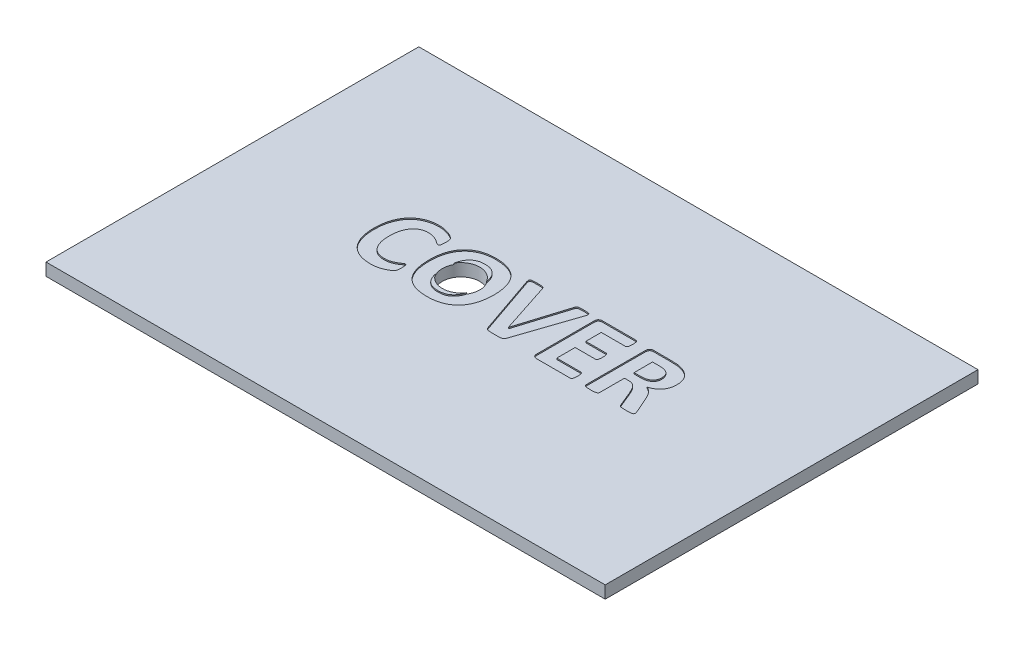
from build123d import *

# Parameters (mm, degrees)
SKETCH1_W           = 450
SKETCH1_H           = 300
BOSS_EXTRUDE1_DEPTH = 10
CUT_EXTRUDE1_DEPTH  = 1
SKETCH3_R           = 15
CUT_EXTRUDE2_DEPTH  = 271.601182693


with BuildPart() as part:
    # Sketch1 → Boss-Extrude1 (new body)
    with BuildSketch(Plane(origin=(0, 0, 0), x_dir=(1, 0, 0), z_dir=(0, 1, 0))):
        Rectangle(SKETCH1_W, SKETCH1_H)
    extrude(amount=BOSS_EXTRUDE1_DEPTH)

    # Sketch2 → Cut-Extrude1 (cut)
    # profile 1 of 5: a face of its own
    with BuildSketch(Plane(origin=(0, 10, 0), x_dir=(1, 0, 0), z_dir=(0, 1, 0))):
        with BuildLine():
            add(Edge.make_bspline(
                [(-77.818627451, -11.20892693), (-77.819056392, -11.517074485), (-77.819847219, -12.08519854), (-77.872230209, -12.871963567), (-77.938067574, -13.535120677), (-78.046155431, -14.093776503), (-78.194888149, -14.565881027), (-78.382858739, -14.998336928), (-78.685088776, -15.422095953), (-78.990876267, -15.821535788), (-79.331447604, -16.201915471), (-79.719445094, -16.524783346), (-80.203030404, -16.902006839), (-81.024618762, -17.468743643), (-82.254477753, -18.184569426), (-83.951977466, -19.004093757), (-85.941522487, -19.709448564), (-88.176283277, -20.306930184), (-90.652982254, -20.707571668), (-92.37964478, -20.754110015), (-93.272920496, -20.778186275)],
                knots=[0, 0, 0, 0, 0.817477301, 1.507162764, 2.091525744, 2.585101367, 3.013698999, 3.403571139, 3.830139735, 4.389521305, 4.739690108, 5.181838318, 5.726127005, 6.367582384, 7.828489835, 9.497787956, 11.362220851, 13.420571043, 15.630867283, 18, 18, 18, 18], degree=3))
            add(Edge.make_bspline(
                [(-93.272920496, -20.778186275), (-94.15329617, -20.756167544), (-95.870805135, -20.7132116), (-98.387183182, -20.406641566), (-100.769794298, -19.888070954), (-103.019268155, -19.156998664), (-105.126176828, -18.224133996), (-107.065135058, -17.057672287), (-108.85634638, -15.705684369), (-110.469499253, -14.134736199), (-111.918111815, -12.3609713), (-113.16386307, -10.363181982), (-114.254794546, -8.175248658), (-115.147706509, -5.777191015), (-115.874822855, -3.180917671), (-116.349261609, -0.372355939), (-116.685308961, 2.628193609), (-116.713441094, 4.698280804), (-116.727941176, 5.765261183)],
                knots=[0, 0, 0, 0, 1.04884528, 2.046173269, 3.015214692, 3.949843553, 4.859908047, 5.754373417, 6.640074381, 7.528023805, 8.430832778, 9.361986752, 10.3273752, 11.339120453, 12.406480085, 13.534714217, 14.729323304, 16, 16, 16, 16], degree=3))
            add(Edge.make_bspline(
                [(-116.727941176, 5.765261183), (-116.709421328, 6.856525006), (-116.673386635, 8.979833717), (-116.32231019, 12.06947672), (-115.772645125, 14.971400049), (-114.994251564, 17.682376672), (-114.008653042, 20.192322768), (-112.841474036, 22.504738019), (-111.489455304, 24.604401381), (-109.961046173, 26.497481008), (-108.249087683, 28.161458028), (-106.392555758, 29.639723814), (-104.360431283, 30.882569218), (-102.176180664, 31.901949539), (-99.858612465, 32.709718645), (-97.415898466, 33.270625779), (-94.860954858, 33.642368443), (-93.116202247, 33.677137663), (-92.22723269, 33.694852941)],
                knots=[0, 0, 0, 0, 1.247364886, 2.427039795, 3.55045214, 4.621200906, 5.64704897, 6.629476075, 7.578181143, 8.497404382, 9.405200954, 10.302706402, 11.205651615, 12.122019826, 13.054178336, 14.006318378, 14.984198529, 16, 16, 16, 16], degree=3))
            add(Edge.make_bspline(
                [(-92.22723269, 33.694852941), (-91.504811834, 33.676204752), (-90.082836554, 33.639498635), (-88.004752592, 33.34953391), (-86.05159818, 32.916201496), (-84.241203878, 32.364338105), (-82.587322738, 31.733463915), (-81.346190212, 31.10277163), (-80.470525668, 30.589526285), (-79.923710494, 30.246611478), (-79.489859624, 29.914630755), (-79.081949007, 29.533243086), (-78.709479477, 29.127043954), (-78.381689893, 28.673729628), (-78.18498315, 28.193912462), (-78.049228642, 27.653022263), (-77.937359141, 27.006781902), (-77.872681032, 26.24637118), (-77.819224155, 25.338208797), (-77.818838943, 24.680977851), (-77.818627451, 24.320140165)],
                knots=[0, 0, 0, 0, 1.99247574, 3.921884623, 5.777623321, 7.507428254, 9.139636718, 10.654923546, 11.341526285, 11.940176233, 12.43448366, 12.845959356, 13.479321404, 13.953882042, 14.379694984, 14.900487377, 15.490617055, 16.187164526, 17.004703962, 18, 18, 18, 18], degree=3))
            add(Edge.make_bspline(
                [(-77.818627451, 24.320140165), (-77.823772031, 23.930992255), (-77.83326467, 23.212947198), (-77.887947583, 22.225715322), (-77.989859493, 21.414444434), (-78.146835758, 20.769212863), (-78.384812578, 20.288972975), (-78.650985702, 19.943983127), (-78.971894595, 19.720663318), (-79.209897835, 19.698396258), (-79.326363358, 19.6875)],
                knots=[0, 0, 0, 0, 1.773747753, 3.272870731, 4.503340964, 5.498117188, 6.282928042, 6.926292104, 7.474587188, 8, 8, 8, 8], degree=3))
            add(Edge.make_bspline(
                [(-79.326363358, 19.6875), (-79.43685259, 19.699070255), (-79.676688326, 19.724185468), (-80.04427271, 19.872481483), (-80.45301119, 20.095429657), (-81.075824236, 20.557783637), (-82.010060994, 21.240083369), (-83.359722572, 22.077805281), (-84.981015831, 22.936050021), (-86.541485603, 23.549687164), (-87.938532187, 23.966157543), (-89.118343345, 24.197799814), (-90.396373735, 24.327451512), (-91.28257443, 24.346675902), (-91.740866268, 24.356617647)],
                knots=[0, 0, 0, 0, 0.294660949, 0.639611878, 1.045415135, 1.533607636, 2.701972583, 4.127801724, 5.759893443, 7.582166846, 8.583129585, 9.639604504, 10.779339718, 12, 12, 12, 12], degree=3))
            add(Edge.make_bspline(
                [(-91.740866268, 24.356617647), (-92.252778184, 24.34603112), (-93.250386641, 24.325400208), (-94.700094095, 24.06441004), (-96.073667948, 23.686639079), (-97.354465673, 23.121059381), (-98.537560814, 22.406191415), (-99.646687153, 21.575984941), (-100.656221828, 20.597368646), (-101.572455758, 19.483075035), (-102.383951452, 18.241853984), (-103.09406497, 16.876636355), (-103.700743529, 15.391322568), (-104.195641932, 13.783133918), (-104.582317067, 12.063315569), (-104.863118167, 10.235529475), (-105.015227204, 8.30100615), (-105.041637093, 6.977369792), (-105.055147059, 6.300264246)],
                knots=[0, 0, 0, 0, 0.972080817, 1.89438068, 2.79201181, 3.675405302, 4.546341706, 5.415605955, 6.303960111, 7.212703157, 8.153143135, 9.118265211, 10.13431466, 11.199471373, 12.313676298, 13.483115176, 14.712488772, 16, 16, 16, 16], degree=3))
            add(Edge.make_bspline(
                [(-105.055147059, 6.300264246), (-105.044779585, 5.562138705), (-105.024750972, 4.136175933), (-104.834819085, 2.073960007), (-104.555239872, 0.161616732), (-104.138105331, -1.597684588), (-103.623500659, -3.20864692), (-102.982962002, -4.666272557), (-102.261337445, -5.9848889), (-101.427984204, -7.151928023), (-100.495913445, -8.171435721), (-99.469167389, -9.050879773), (-98.354813607, -9.797138672), (-97.154254511, -10.414504176), (-95.859235222, -10.870936809), (-94.48518927, -11.195649518), (-93.036664812, -11.41349957), (-92.041609589, -11.4310174), (-91.534160539, -11.43995098)],
                knots=[0, 0, 0, 0, 1.39820726, 2.701155002, 3.920851914, 5.057115416, 6.123247462, 7.120555937, 8.069346848, 8.966541661, 9.830790757, 10.680415293, 11.521739042, 12.366630257, 13.231390995, 14.116141633, 15.039287353, 16, 16, 16, 16], degree=3))
            add(Edge.make_bspline(
                [(-91.534160539, -11.43995098), (-91.07582635, -11.430322574), (-90.193575003, -11.411788772), (-88.91614259, -11.278417947), (-87.739189118, -11.052803367), (-86.336399014, -10.629953332), (-84.784960903, -9.996172863), (-83.16651359, -9.138299852), (-81.826569015, -8.301422775), (-80.880443463, -7.644303913), (-80.259062826, -7.177481653), (-79.855152386, -6.962438443), (-79.510973857, -6.809577123), (-79.290981156, -6.782804548), (-79.192612592, -6.770833333)],
                knots=[0, 0, 0, 0, 1.227460679, 2.362749415, 3.435761231, 4.43188492, 6.282452832, 7.914022885, 9.332840532, 10.51031958, 11.001231841, 11.409295861, 11.73586979, 12, 12, 12, 12], degree=3))
            add(Edge.make_bspline(
                [(-79.192612592, -6.770833333), (-79.07005097, -6.775203133), (-78.845536848, -6.783207936), (-78.526164361, -6.911731198), (-78.291790808, -7.195877136), (-78.118967805, -7.616756716), (-77.9754213, -8.202223818), (-77.889336615, -8.989807691), (-77.830624973, -10.012357435), (-77.822936443, -10.779170788), (-77.818627451, -11.20892693)],
                knots=[0, 0, 0, 0, 0.574868731, 1.05307148, 1.566117152, 2.257286433, 3.182192672, 4.393071976, 5.978517896, 8, 8, 8, 8], degree=3))
        make_face()
    # profile 2 of 5: a face of its own
    with BuildSketch(Plane(origin=(0, 10, 0), x_dir=(1, 0, 0), z_dir=(0, 1, 0))):
        with BuildLine():
            add(Edge.make_bspline(
                [(-21.789215686, 7.06629136), (-21.804502794, 6.003463614), (-21.834332669, 3.929558034), (-22.164338877, 0.911182765), (-22.662042797, -1.942991904), (-23.393429497, -4.614726142), (-24.311362584, -7.112085632), (-25.448171656, -9.40869449), (-26.776553625, -11.518348138), (-28.315195116, -13.424042499), (-30.053601317, -15.125475558), (-31.985137389, -16.619756613), (-34.120682453, -17.886788425), (-36.437839035, -18.947871535), (-38.94857491, -19.779295187), (-41.652360688, -20.352090312), (-44.541536754, -20.710901344), (-46.532013277, -20.755352634), (-47.554476869, -20.778186275)],
                knots=[0, 0, 0, 0, 1.181067455, 2.304627813, 3.371397041, 4.398875488, 5.379772852, 6.324840374, 7.24235265, 8.145895775, 9.041233988, 9.940678369, 10.854054564, 11.795635534, 12.76881339, 13.787809768, 14.863646999, 16, 16, 16, 16], degree=3))
            add(Edge.make_bspline(
                [(-47.554476869, -20.778186275), (-48.560515707, -20.762007713), (-50.512643947, -20.730614663), (-53.34167642, -20.417584641), (-55.977323691, -19.932404609), (-58.414377062, -19.22619889), (-60.655988851, -18.315546989), (-62.703244348, -17.187562822), (-64.568838473, -15.862406968), (-66.223766539, -14.299117068), (-67.681653696, -12.521281284), (-68.935875865, -10.518758858), (-70.012317298, -8.302825895), (-70.882285438, -5.854889164), (-71.562391435, -3.184948232), (-72.022441829, -0.28261615), (-72.321488504, 2.844846743), (-72.354342912, 5.01065176), (-72.371323529, 6.130035999)],
                knots=[0, 0, 0, 0, 1.14605125, 2.223809784, 3.239278066, 4.196657126, 5.110123641, 5.990760065, 6.854667985, 7.710749604, 8.577135683, 9.46770869, 10.397275983, 11.379066547, 12.423123567, 13.532494508, 14.724683554, 16, 16, 16, 16], degree=3))
            add(Edge.make_bspline(
                [(-72.371323529, 6.130035999), (-72.348849221, 7.168273289), (-72.304942518, 9.196615031), (-72.005602589, 12.158338577), (-71.477779286, 14.953772427), (-70.768289905, 17.589872412), (-69.844890326, 20.055757758), (-68.716376506, 22.336188455), (-67.380138563, 24.425159799), (-65.841877559, 26.317384183), (-64.107541731, 28.018627669), (-62.176944132, 29.507953333), (-60.050335874, 30.783228424), (-57.729091949, 31.839857087), (-55.212663117, 32.683782666), (-52.501272734, 33.270709951), (-49.598663394, 33.627895575), (-47.60012817, 33.672072923), (-46.569584865, 33.694852941)],
                knots=[0, 0, 0, 0, 1.160914008, 2.268007866, 3.323978369, 4.338756358, 5.316875162, 6.263384146, 7.178594241, 8.083875972, 8.984426194, 9.889106488, 10.803912537, 11.750974708, 12.735550296, 13.765875032, 14.847975007, 16, 16, 16, 16], degree=3))
            add(Edge.make_bspline(
                [(-46.569584865, 33.694852941), (-45.583831494, 33.67848273), (-43.668134127, 33.646669122), (-40.887235801, 33.334848928), (-38.287106836, 32.842731782), (-35.864242001, 32.154699494), (-33.625549625, 31.251793742), (-31.56673949, 30.150084302), (-29.710986082, 28.807584493), (-28.050469734, 27.250631089), (-26.56262548, 25.49230798), (-25.301818471, 23.498924948), (-24.208237958, 21.306366184), (-23.328004263, 18.885512748), (-22.637413564, 16.247299169), (-22.146960049, 13.387690332), (-21.83663093, 10.303427329), (-21.805374797, 8.169506993), (-21.789215686, 7.06629136)],
                knots=[0, 0, 0, 0, 1.132472299, 2.200828589, 3.21116476, 4.170875335, 5.090315408, 5.980258557, 6.84769598, 7.714420291, 8.590505985, 9.487188694, 10.418317356, 11.401257481, 12.441795894, 13.548338263, 14.732515217, 16, 16, 16, 16], degree=3))
        make_face()
        with BuildLine():
            add(Edge.make_bspline(
                [(-33.462009804, 6.482651654), (-33.467766392, 7.167808774), (-33.479016769, 8.506844376), (-33.603061788, 10.466679313), (-33.806183629, 12.329842781), (-34.09779503, 14.09158646), (-34.46412486, 15.755102542), (-34.957755222, 17.295395681), (-35.574332191, 18.709727613), (-36.285226511, 20.006339262), (-37.130669746, 21.174032008), (-38.107642926, 22.206456593), (-39.228638726, 23.082359388), (-40.465746827, 23.839486864), (-41.860045518, 24.421971128), (-43.4063391, 24.851875839), (-45.119560357, 25.086182463), (-46.3135667, 25.118171857), (-46.934359681, 25.134803922)],
                knots=[0, 0, 0, 0, 1.248306964, 2.439626501, 3.576526119, 4.66195957, 5.692118455, 6.677712867, 7.603820791, 8.499754584, 9.366886977, 10.223578091, 11.080555655, 11.951954716, 12.85865995, 13.824437323, 14.868871972, 16, 16, 16, 16], degree=3))
            add(Edge.make_bspline(
                [(-46.934359681, 25.134803922), (-47.563702556, 25.116811317), (-48.772339973, 25.082256965), (-50.509450448, 24.80019835), (-52.086894499, 24.332530657), (-53.503339809, 23.666438867), (-54.759925664, 22.841864614), (-55.893725247, 21.898098101), (-56.894255515, 20.820146428), (-57.769297497, 19.621519701), (-58.535045556, 18.313902389), (-59.13866571, 16.879064451), (-59.677896124, 15.358346713), (-60.047962595, 13.72722523), (-60.339680332, 12.029873081), (-60.539249583, 10.275740159), (-60.685048486, 8.475154759), (-60.693999804, 7.257092791), (-60.698529412, 6.640720741)],
                knots=[0, 0, 0, 0, 1.153225958, 2.214741912, 3.216094119, 4.16009031, 5.073077605, 5.964494141, 6.858230186, 7.761795903, 8.68066018, 9.629003448, 10.611206296, 11.634860154, 12.690273443, 13.767663655, 14.870377893, 16, 16, 16, 16], degree=3))
            add(Edge.make_bspline(
                [(-60.698529412, 6.640720741), (-60.692596677, 5.931284855), (-60.681026944, 4.547777442), (-60.560439211, 2.530731615), (-60.34806307, 0.625174334), (-60.084767554, -1.174213956), (-59.692521843, -2.851477705), (-59.211770898, -4.41464957), (-58.601395755, -5.844492745), (-57.902976524, -7.159484512), (-57.066497166, -8.33350057), (-56.093081613, -9.358442171), (-54.978432678, -10.229839061), (-53.744653158, -10.972375417), (-52.340508405, -11.534901481), (-50.78193574, -11.924884503), (-49.057902065, -12.173389096), (-47.85532032, -12.202767628), (-47.226179534, -12.218137255)],
                knots=[0, 0, 0, 0, 1.279653928, 2.495518946, 3.642823718, 4.737874749, 5.773595616, 6.747088542, 7.68406817, 8.573908718, 9.428072391, 10.276175527, 11.114292987, 11.973199623, 12.865200127, 13.831639063, 14.865603682, 16, 16, 16, 16], degree=3))
            add(Edge.make_bspline(
                [(-47.226179534, -12.218137255), (-46.596809057, -12.200306559), (-45.38811863, -12.166063149), (-43.656369928, -11.882672062), (-42.083958027, -11.425211542), (-40.665794551, -10.776779903), (-39.412990749, -9.944261831), (-38.262890885, -9.010179968), (-37.267831115, -7.91367903), (-36.385704588, -6.703528208), (-35.633139254, -5.371100361), (-34.999694539, -3.928682454), (-34.49028442, -2.380682023), (-34.109296908, -0.734414577), (-33.820613257, 0.988330713), (-33.62128015, 2.774709616), (-33.475517953, 4.611799549), (-33.46654793, 5.854130172), (-33.462009804, 6.482651654)],
                knots=[0, 0, 0, 0, 1.144095152, 2.197206425, 3.181453363, 4.114866049, 5.020624657, 5.910648687, 6.802715632, 7.705078328, 8.629453105, 9.579998293, 10.566037856, 11.588758084, 12.650348858, 13.741173613, 14.857211693, 16, 16, 16, 16], degree=3))
        make_face(mode=Mode.SUBTRACT)
    # profile 3 of 5: a face of its own
    with BuildSketch(Plane(origin=(0, 10, 0), x_dir=(1, 0, 0), z_dir=(0, 1, 0))):
        with BuildLine():
            add(Edge.make_bspline(
                [(13.399394914, -17.896465227), (13.330728837, -18.106576979), (13.202549366, -18.498794132), (12.888042929, -19.019521625), (12.420613316, -19.436550572), (11.73779657, -19.701530168), (10.834088074, -19.873657059), (9.922973436, -19.937873715), (9.04647571, -19.964014043), (8.264353093, -19.991765838), (7.380639784, -20.002459103), (6.760493672, -20.000851203), (6.432195925, -20)],
                knots=[0, 0, 0, 0, 0.838483291, 1.565202924, 2.285525397, 3.175638207, 4.308717692, 5.77750847, 6.640818347, 7.642709929, 8.752079542, 10, 10, 10, 10], degree=3))
            add(Edge.make_bspline(
                [(6.432195925, -20), (5.921516841, -20.000733166), (4.977146898, -20.002088969), (3.667723097, -19.993540219), (2.564560339, -19.961728838), (1.646162726, -19.895268101), (0.896361034, -19.782173917), (0.283437725, -19.660887962), (-0.203940221, -19.470044145), (-0.605786067, -19.255578457), (-0.919580534, -18.979547969), (-1.165726232, -18.644022475), (-1.33742685, -18.230657956), (-1.440564405, -17.933417915), (-1.495576746, -17.774873621)],
                knots=[0, 0, 0, 0, 2.065956449, 3.8204564, 5.296959174, 6.530624034, 7.541636879, 8.365060191, 9.0501898, 9.652188513, 10.19821837, 10.726225753, 11.320584009, 12, 12, 12, 12], degree=3))
            Line((-1.495576746, -17.774873621), (-17.509191176, 28.69743796))
            add(Edge.make_bspline(
                [(-17.509191176, 28.69743796), (-17.58232077, 28.928362802), (-17.720487697, 29.364659168), (-17.911240722, 29.976760734), (-18.026496103, 30.520049283), (-18.125188557, 30.982725084), (-18.148373239, 31.3929318), (-18.068739078, 31.743547578), (-17.937625986, 32.053015296), (-17.704338906, 32.303625177), (-17.386349444, 32.502729656), (-16.977253961, 32.639075903), (-16.488224732, 32.747586299), (-15.905632184, 32.81606485), (-15.219717255, 32.859826509), (-14.41310112, 32.900461524), (-13.484461617, 32.903021119), (-12.823843134, 32.911953771), (-12.475298713, 32.916666667)],
                knots=[0, 0, 0, 0, 1.275097074, 2.409096461, 3.37162946, 4.195875074, 4.900146373, 5.510995092, 6.074169784, 6.648148811, 7.281310597, 8.030356235, 8.9049585, 9.915687935, 11.113310156, 12.522660173, 14.165344402, 16, 16, 16, 16], degree=3))
            add(Edge.make_bspline(
                [(-12.475298713, 32.916666667), (-12.175326332, 32.919345322), (-11.611739996, 32.924377964), (-10.817644917, 32.891472631), (-10.128052701, 32.873806883), (-9.381488527, 32.825705953), (-8.627635567, 32.753143109), (-7.900074974, 32.589061604), (-7.355311116, 32.348916359), (-7.028860223, 31.940662273), (-6.799274523, 31.470489019), (-6.679429671, 31.12283443), (-6.614583333, 30.934723499)],
                knots=[0, 0, 0, 0, 1.327706146, 2.494486448, 3.517808369, 4.380703587, 5.807288056, 6.860376529, 7.686876677, 8.373845822, 9.120111207, 10, 10, 10, 10], degree=3))
            Line((-6.614583333, 30.934723499), (6.578105852, -9.506644455))
            Line((6.578105852, -9.506644455), (6.614583333, -9.506644455))
            Line((6.614583333, -9.506644455), (19.065563725, 30.72801777))
            add(Edge.make_bspline(
                [(19.065563725, 30.72801777), (19.126682088, 30.939499139), (19.237075651, 31.321482241), (19.446428663, 31.855763602), (19.822257383, 32.26516737), (20.377019048, 32.564290401), (21.14123914, 32.758834776), (21.933715204, 32.825825945), (22.708796699, 32.873478667), (23.430729503, 32.891679046), (24.253231846, 32.924183798), (24.837070067, 32.919263147), (25.145143995, 32.916666667)],
                knots=[0, 0, 0, 0, 0.926230152, 1.672980775, 2.38414643, 3.207679395, 4.285745138, 5.673211603, 6.542959351, 7.547978764, 8.706141892, 10, 10, 10, 10], degree=3))
            add(Edge.make_bspline(
                [(25.145143995, 32.916666667), (25.445007792, 32.911334385), (26.012323955, 32.901246174), (26.808056619, 32.906357139), (27.495869788, 32.842676985), (28.086332472, 32.807520602), (28.584546382, 32.725373106), (28.99959038, 32.604810354), (29.336196525, 32.442878899), (29.654782738, 32.139624769), (29.893596265, 31.60104995), (29.821386265, 30.794572826), (29.583942952, 29.789996503), (29.328055354, 29.04802668), (29.181985294, 28.624482996)],
                knots=[0, 0, 0, 0, 1.300449487, 2.460337065, 3.446878253, 4.293259651, 5.024138121, 5.630054992, 6.164487643, 6.624391872, 7.51295335, 8.602561365, 10.06061698, 12, 12, 12, 12], degree=3))
            Line((29.181985294, 28.624482996), (13.399394914, -17.896465227))
        make_face()
    # profile 4 of 5: a face of its own
    with BuildSketch(Plane(origin=(0, 10, 0), x_dir=(1, 0, 0), z_dir=(0, 1, 0))):
        with BuildLine():
            add(Edge.make_bspline(
                [(68.480392157, -15.71997549), (68.478644844, -16.089144706), (68.475451529, -16.763822837), (68.384077853, -17.680536259), (68.277038062, -18.426164406), (68.09653405, -19.009371665), (67.865401329, -19.45939241), (67.572081609, -19.775699947), (67.225489577, -19.960745366), (66.982645385, -19.987059637), (66.863223805, -20)],
                knots=[0, 0, 0, 0, 1.772437912, 3.239232977, 4.423707261, 5.384401224, 6.159891517, 6.834724464, 7.426961607, 8, 8, 8, 8], degree=3))
            Line((66.863223805, -20), (39.821250766, -20))
            add(Edge.make_bspline(
                [(39.821250766, -20), (39.60174859, -19.990742591), (39.17380329, -19.972694183), (38.555238906, -19.829544757), (38.003447519, -19.56108256), (37.490302335, -19.227088052), (37.062611053, -18.752843642), (36.775972685, -18.139659332), (36.60521931, -17.411150581), (36.585397641, -16.888316576), (36.574754902, -16.60759421)],
                knots=[0, 0, 0, 0, 0.986134925, 1.922585978, 2.82696586, 3.731162354, 4.659788764, 5.653462416, 6.740086574, 8, 8, 8, 8], degree=3))
            Line((36.574754902, -16.60759421), (36.574754902, 29.524260876))
            add(Edge.make_bspline(
                [(36.574754902, 29.524260876), (36.585614736, 29.804900857), (36.605840735, 30.327581423), (36.773132331, 31.053527241), (37.065758906, 31.660465407), (37.493943753, 32.129895493), (38.001804622, 32.483175985), (38.565196987, 32.742629292), (39.189551043, 32.891056305), (39.621858707, 32.907933212), (39.845569087, 32.916666667)],
                knots=[0, 0, 0, 0, 1.255398639, 2.338128977, 3.311977815, 4.237276575, 5.148590167, 6.066205518, 6.999300883, 8, 8, 8, 8], degree=3))
            Line((39.845569087, 32.916666667), (66.887542126, 32.916666667))
            add(Edge.make_bspline(
                [(66.887542126, 32.916666667), (67.00688587, 32.908389821), (67.244734868, 32.891894283), (67.579091065, 32.720260755), (67.866314834, 32.410318434), (68.079313357, 31.945897737), (68.28062216, 31.349392709), (68.381541467, 30.58834897), (68.476929265, 29.660487959), (68.47915971, 28.977534903), (68.480392157, 28.600164675)],
                knots=[0, 0, 0, 0, 0.566414176, 1.128848811, 1.744661206, 2.549421896, 3.546753268, 4.742756138, 6.200188366, 8, 8, 8, 8], degree=3))
            add(Edge.make_bspline(
                [(68.480392157, 28.600164675), (68.47878958, 28.239049161), (68.475848912, 27.576416058), (68.381657059, 26.672496952), (68.281295229, 25.928100504), (68.083635379, 25.347821428), (67.851343532, 24.906340585), (67.58515139, 24.578553053), (67.246216146, 24.394425216), (67.006962472, 24.369205659), (66.887542126, 24.356617647)],
                knots=[0, 0, 0, 0, 1.754513308, 3.219464557, 4.418295359, 5.396805865, 6.181695552, 6.838026381, 7.420016048, 8, 8, 8, 8], degree=3))
            Line((66.887542126, 24.356617647), (47.469362745, 24.356617647))
            Line((47.469362745, 24.356617647), (47.469362745, 11.905637255))
            Line((47.469362745, 11.905637255), (63.738319547, 11.905637255))
            add(Edge.make_bspline(
                [(63.738319547, 11.905637255), (63.86259004, 11.89434534), (64.113064018, 11.871585868), (64.451495437, 11.66631155), (64.7575792, 11.366507511), (64.982358073, 10.913523253), (65.167950042, 10.324800656), (65.268376574, 9.569298317), (65.363429346, 8.645315974), (65.366155414, 7.970525249), (65.367647059, 7.601294424)],
                knots=[0, 0, 0, 0, 0.588344271, 1.185840062, 1.842418932, 2.6128118, 3.567190965, 4.782059029, 6.239212611, 8, 8, 8, 8], degree=3))
            add(Edge.make_bspline(
                [(65.367647059, 7.601294424), (65.365782678, 7.228098058), (65.362372002, 6.545377252), (65.272418735, 5.620279934), (65.163556566, 4.871097226), (64.986719706, 4.29015513), (64.752367459, 3.848709704), (64.458512069, 3.543889194), (64.107100238, 3.370245794), (63.861652376, 3.353834563), (63.738319547, 3.345588235)],
                knots=[0, 0, 0, 0, 1.788442105, 3.271753817, 4.453938487, 5.412775407, 6.169742938, 6.829388584, 7.411790278, 8, 8, 8, 8], degree=3))
            Line((63.738319547, 3.345588235), (47.469362745, 3.345588235))
            Line((47.469362745, 3.345588235), (47.469362745, -11.43995098))
            Line((47.469362745, -11.43995098), (66.863223805, -11.43995098))
            add(Edge.make_bspline(
                [(66.863223805, -11.43995098), (66.982796282, -11.452755065), (67.225947324, -11.478792214), (67.56746662, -11.664653996), (67.873419751, -11.970167456), (68.09177791, -12.429522386), (68.280013572, -13.016686021), (68.381375671, -13.764088474), (68.476573524, -14.679953011), (68.479036406, -15.350730591), (68.480392157, -15.71997549)],
                knots=[0, 0, 0, 0, 0.572817642, 1.164826637, 1.825495256, 2.617848232, 3.578172107, 4.781394644, 6.228244884, 8, 8, 8, 8], degree=3))
        make_face()
    # profile 5 of 5: a face of its own
    with BuildSketch(Plane(origin=(0, 10, 0), x_dir=(1, 0, 0), z_dir=(0, 1, 0))):
        with BuildLine():
            add(Edge.make_bspline(
                [(117.506127451, -18.382831648), (117.501576145, -18.517589009), (117.492892851, -18.774688382), (117.35493606, -19.144698274), (117.038797065, -19.466401038), (116.488469196, -19.674868978), (115.702304931, -19.834251931), (114.873525261, -19.922255697), (114.049465523, -19.972242354), (113.290710184, -19.969723519), (112.423863696, -20.009117904), (111.811639623, -20.003157331), (111.487342984, -20)],
                knots=[0, 0, 0, 0, 0.591319522, 1.128160102, 1.696130589, 2.518752957, 3.670424272, 5.233177541, 6.180486275, 7.30487453, 8.572385225, 10, 10, 10, 10], degree=3))
            add(Edge.make_bspline(
                [(111.487342984, -20), (110.968682997, -19.992326577), (110.044545356, -19.97865423), (108.812193537, -19.95495852), (107.860184758, -19.828516369), (107.132520263, -19.664108783), (106.591798221, -19.41309978), (106.226800155, -19.069222136), (106.016430952, -18.650739875), (105.8962364, -18.363124899), (105.833333333, -18.212603401)],
                knots=[0, 0, 0, 0, 1.94662298, 3.468452578, 4.619005538, 5.544708335, 6.258749361, 6.828725966, 7.387021064, 8, 8, 8, 8], degree=3))
            Line((105.833333333, -18.212603401), (101.01830576, -6.442535999))
            add(Edge.make_bspline(
                [(101.01830576, -6.442535999), (100.735539531, -5.807892937), (100.201179078, -4.608569543), (99.363877634, -2.936674746), (98.506949816, -1.488503288), (97.517897492, -0.305876398), (96.406662757, 0.640591171), (95.119466351, 1.306906939), (93.651356968, 1.726512646), (92.607254478, 1.767575334), (92.057004442, 1.789215686)],
                knots=[0, 0, 0, 0, 1.274400747, 2.408312201, 3.429775496, 4.353228678, 5.22430954, 6.089020439, 6.992899086, 8, 8, 8, 8], degree=3))
            Line((92.057004442, 1.789215686), (88.713235294, 1.789215686))
            Line((88.713235294, 1.789215686), (88.713235294, -18.285558364))
            add(Edge.make_bspline(
                [(88.713235294, -18.285558364), (88.70304738, -18.418045849), (88.682285528, -18.688040817), (88.452523786, -19.057437832), (88.070178756, -19.363340478), (87.507788791, -19.582720414), (86.76680212, -19.755352833), (85.816143836, -19.903513002), (84.616702207, -19.977364322), (83.73210484, -19.991925895), (83.241613051, -20)],
                knots=[0, 0, 0, 0, 0.508410858, 1.036085586, 1.626982877, 2.379311475, 3.350140591, 4.573428586, 6.100033754, 8, 8, 8, 8], degree=3))
            add(Edge.make_bspline(
                [(83.241613051, -20), (82.763315471, -19.991603104), (81.886904287, -19.976217005), (80.691226256, -19.903494083), (79.733271289, -19.755460117), (78.989034439, -19.586583182), (78.437728468, -19.358393733), (78.04998887, -19.064626617), (77.854872036, -18.680879365), (77.830676566, -18.416978494), (77.818627451, -18.285558364)],
                knots=[0, 0, 0, 0, 1.863476628, 3.41455158, 4.660430775, 5.63680735, 6.378967734, 6.973241497, 7.488684008, 8, 8, 8, 8], degree=3))
            Line((77.818627451, -18.285558364), (77.818627451, 29.536420037))
            add(Edge.make_bspline(
                [(77.818627451, 29.536420037), (77.830539949, 29.812699283), (77.853046689, 30.33468427), (78.010864934, 31.060366968), (78.314529934, 31.658317646), (78.723882273, 32.129832193), (79.221142071, 32.482765801), (79.772122219, 32.742585259), (80.380688721, 32.890120052), (80.800899796, 32.907665219), (81.016486673, 32.916666667)],
                knots=[0, 0, 0, 0, 1.255139882, 2.371383969, 3.342844043, 4.269311035, 5.178797513, 6.092929471, 7.021588424, 8, 8, 8, 8], degree=3))
            Line((81.016486673, 32.916666667), (94.732019761, 32.916666667))
            add(Edge.make_bspline(
                [(94.732019761, 32.916666667), (95.064406605, 32.919205872), (95.70091388, 32.924068346), (96.608554244, 32.891147838), (97.423631452, 32.873653176), (98.363914477, 32.821286812), (99.422968559, 32.757802762), (100.240319995, 32.675950813), (100.629212623, 32.637005974)],
                knots=[0, 0, 0, 0, 1.012794642, 1.939460509, 2.767356448, 3.497015972, 4.809089956, 6, 6, 6, 6], degree=3))
            add(Edge.make_bspline(
                [(100.629212623, 32.637005974), (101.148939652, 32.553208766), (102.169565824, 32.388650028), (103.656460032, 32.054862834), (105.054248304, 31.6106918), (106.374768029, 31.104670313), (107.607497061, 30.507026622), (108.747755353, 29.829601544), (109.797150762, 29.072260572), (110.730695219, 28.216112956), (111.577195343, 27.287246648), (112.325923231, 26.278817005), (112.9440575, 25.170027155), (113.469139813, 23.990950154), (113.88442951, 22.724317205), (114.191271613, 21.37402354), (114.356891807, 19.926710532), (114.380980451, 18.93402556), (114.393382353, 18.422947304)],
                knots=[0, 0, 0, 0, 1.151418638, 2.261125421, 3.329441394, 4.356764664, 5.35198948, 6.322018693, 7.254748064, 8.177310221, 9.087349105, 10.000534908, 10.917628462, 11.858287172, 12.819893749, 13.828610564, 14.882072401, 16, 16, 16, 16], degree=3))
            add(Edge.make_bspline(
                [(114.393382353, 18.422947304), (114.389429752, 17.988764118), (114.381725602, 17.142482919), (114.232225895, 15.90128246), (114.042007779, 14.713907778), (113.728174883, 13.591085369), (113.353338111, 12.52927904), (112.901658714, 11.522366576), (112.365248903, 10.576432797), (111.757526459, 9.680103748), (111.056114116, 8.853840143), (110.291693537, 8.073454397), (109.447730927, 7.349718816), (108.197567993, 6.472958425), (106.464122428, 5.486383389), (104.947587249, 4.94791055), (104.167528339, 4.670936734)],
                knots=[0, 0, 0, 0, 0.984128184, 1.918197676, 2.832650415, 3.70915726, 4.55828255, 5.385371142, 6.208721057, 7.022207663, 7.837977017, 8.663633597, 9.498301217, 10.355451789, 12.125356837, 14, 14, 14, 14], degree=3))
            add(Edge.make_bspline(
                [(104.167528339, 4.670936734), (104.565666146, 4.468811088), (105.362138923, 4.0644597), (106.473505625, 3.297940834), (107.529580516, 2.400942014), (108.498280879, 1.31487608), (109.422012608, 0.073874315), (110.287419435, -1.342589824), (111.115292261, -2.934966665), (111.623155678, -4.072668152), (111.888595282, -4.66729856)],
                knots=[0, 0, 0, 0, 0.862491229, 1.725409574, 2.603460875, 3.535458815, 4.5322819, 5.591415034, 6.741130359, 8, 8, 8, 8], degree=3))
            Line((111.888595282, -4.66729856), (116.460439645, -15.014744179))
            add(Edge.make_bspline(
                [(116.460439645, -15.014744179), (116.559069089, -15.253343111), (116.740523833, -15.692308453), (116.972026137, -16.305785094), (117.156802924, -16.815974094), (117.323505658, -17.332071545), (117.467989896, -17.83990834), (117.494686273, -18.219955916), (117.506127451, -18.382831648)],
                knots=[0, 0, 0, 0, 1.311865282, 2.41352042, 3.332073222, 4.068080627, 5.172043703, 6, 6, 6, 6], degree=3))
        make_face()
        with BuildLine():
            add(Edge.make_bspline(
                [(103.49877451, 17.061121324), (103.486810994, 17.475712375), (103.463618723, 18.279431682), (103.226915921, 19.430895092), (102.847719075, 20.480796051), (102.322573624, 21.435093964), (101.619864294, 22.277605597), (100.718212611, 22.984127716), (99.621626949, 23.543499112), (98.806084129, 23.790021139), (98.379767923, 23.918887868)],
                knots=[0, 0, 0, 0, 1.06541259, 2.065391104, 3.008807556, 3.928413024, 4.853617449, 5.811161198, 6.855808141, 8, 8, 8, 8], degree=3))
            add(Edge.make_bspline(
                [(98.379767923, 23.918887868), (98.084669016, 23.983782889), (97.461964453, 24.12072147), (96.639039642, 24.227551453), (95.887368126, 24.285545788), (95.211336354, 24.344802669), (94.431953454, 24.341673934), (93.880827642, 24.351444864), (93.58905867, 24.356617647)],
                knots=[0, 0, 0, 0, 1.127497783, 2.379195572, 3.092833242, 3.942220738, 4.910600581, 6, 6, 6, 6], degree=3))
            Line((93.58905867, 24.356617647), (88.713235294, 24.356617647))
            Line((88.713235294, 24.356617647), (88.713235294, 9.571078431))
            Line((88.713235294, 9.571078431), (94.245653339, 9.571078431))
            add(Edge.make_bspline(
                [(94.245653339, 9.571078431), (94.618716562, 9.578792858), (95.341832335, 9.593745883), (96.395097471, 9.688766497), (97.374230391, 9.858581705), (98.287647989, 10.087217498), (99.119755985, 10.391326023), (99.88640035, 10.746417155), (100.576844525, 11.155768452), (101.391428507, 11.772310582), (102.237366777, 12.69017976), (102.974701986, 13.995860831), (103.421473233, 15.476228622), (103.472528167, 16.522997789), (103.49877451, 17.061121324)],
                knots=[0, 0, 0, 0, 0.997048219, 1.932598153, 2.822976353, 3.650522851, 4.445456231, 5.186855846, 5.905759209, 6.586005233, 7.91212848, 9.207278324, 10.564316464, 12, 12, 12, 12], degree=3))
        make_face(mode=Mode.SUBTRACT)
    extrude(amount=-CUT_EXTRUDE1_DEPTH, mode=Mode.SUBTRACT)

    # Sketch3 → Cut-Extrude2 (cut, through all)
    with BuildSketch(Plane(origin=(0, 10, 0), x_dir=(1, 0, 0), z_dir=(0, 1, 0))):
        with Locations(Location((-47, 6, 0), (0, 0, 270))):
            Circle(SKETCH3_R)
    extrude(amount=-CUT_EXTRUDE2_DEPTH, mode=Mode.SUBTRACT)


solid = part.part
